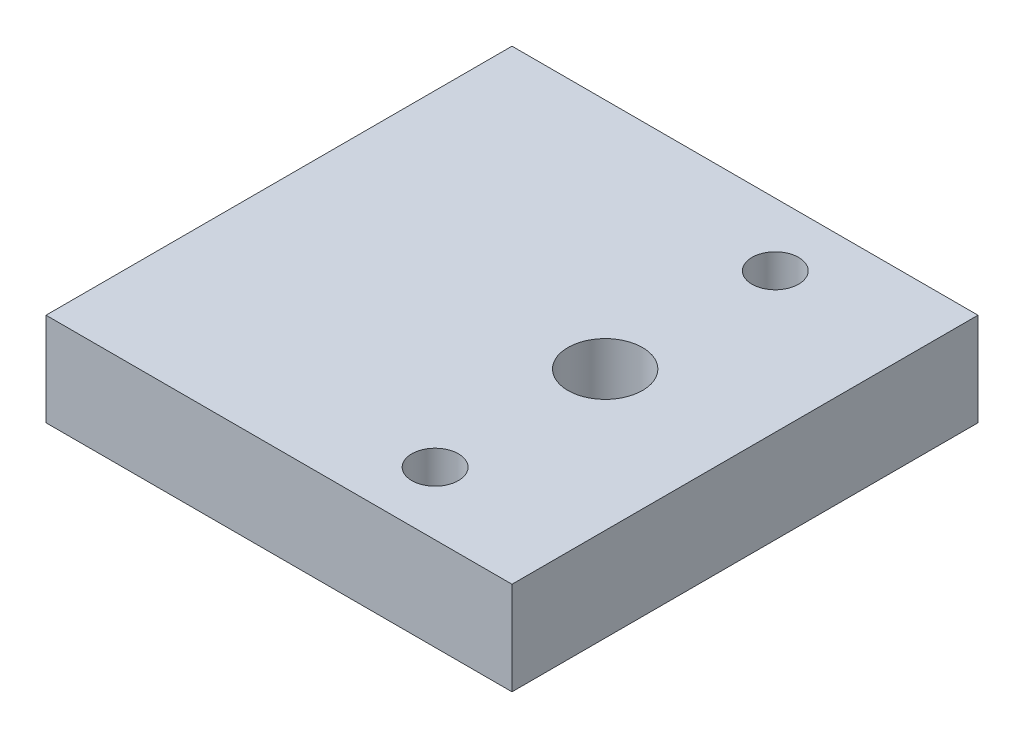
from build123d import *

# Parameters (mm, degrees)
ESBO_O2_W                = 50
ESBO_O2_H                = 50
RESSALTO_EXTRUS_O2_DEPTH = 10
ESBO_O5_R                = 2.5
CORTE_EXTRUS_O5_DEPTH    = 37.742346142
ESBO_O6_R                = 4
CORTE_EXTRUS_O6_DEPTH    = 10


with BuildPart() as part:
    # Esboço2 → Ressalto-extrusão2 (new body)
    with BuildSketch(Plane(origin=(0, 0, 0), x_dir=(1, 0, 0), z_dir=(0, 1, 0))):
        Rectangle(ESBO_O2_W, ESBO_O2_H)
    extrude(amount=RESSALTO_EXTRUS_O2_DEPTH)

    # Esboço5 → Corte-extrusão5 (cut, through all)
    with BuildSketch(Plane(origin=(0, 10, 0), x_dir=(1, 0, 0), z_dir=(0, 1, 0))):
        with Locations(Location((10, 18.25, 0), (0, 0, 270))):
            Circle(ESBO_O5_R)
        with Locations(Location((10, -18.25, 0), (0, 0, 270))):
            Circle(ESBO_O5_R)
    extrude(amount=-CORTE_EXTRUS_O5_DEPTH, mode=Mode.SUBTRACT)

    # Esboço6 → Corte-extrusão6 (cut)
    with BuildSketch(Plane(origin=(0, 10, 0), x_dir=(1, 0, 0), z_dir=(0, 1, 0))):
        with Locations(Location((10, 0, 0), (0, 0, 270))):
            Circle(ESBO_O6_R)
    extrude(amount=-CORTE_EXTRUS_O6_DEPTH, mode=Mode.SUBTRACT)


solid = part.part
